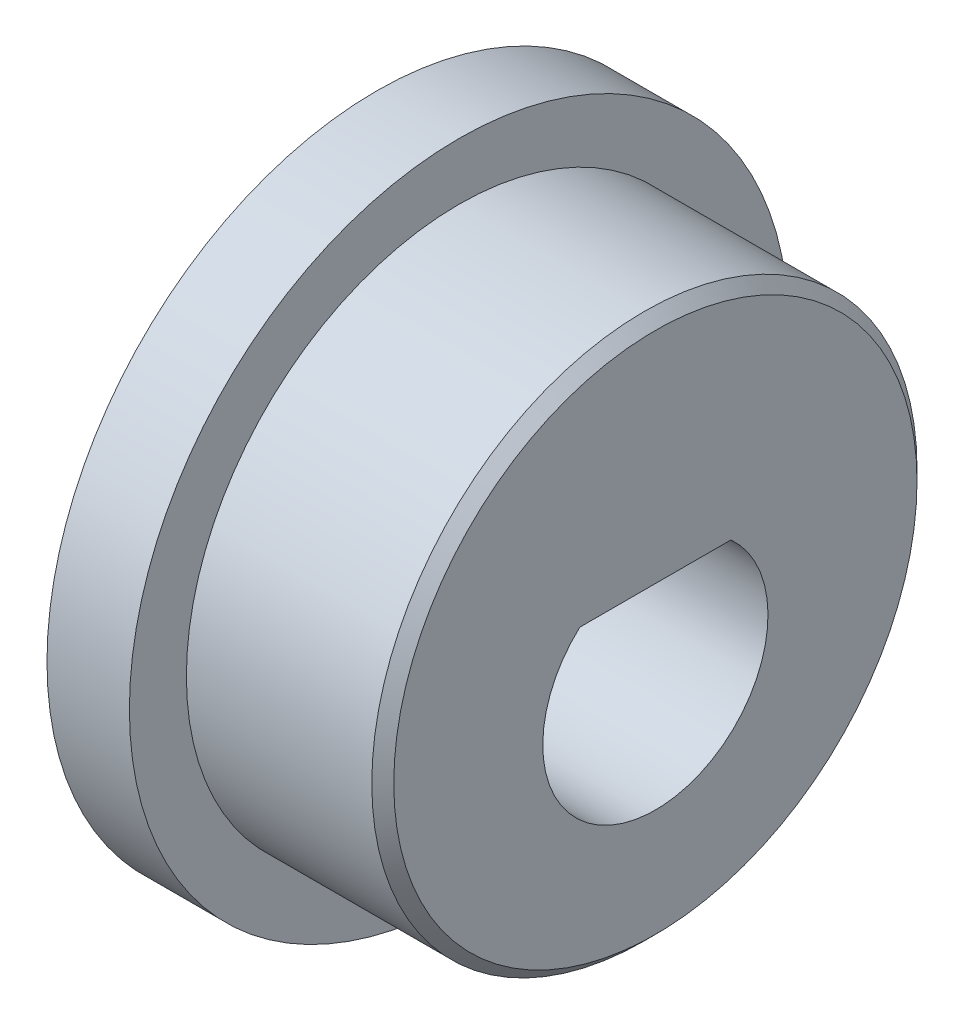
from build123d import *

# Parameters (mm, degrees)
SKIZZE1_R                            = 9.925
AUFSATZ_LINEAR_AUSTRAGEN1_DEPTH      = 7.15
SKIZZE2_R                            = 12
AUFSATZ_LINEAR_AUSTRAGEN2_DEPTH      = 3
SCHNITT_LINEAR_AUSTRAGEN2_DEPTH      = 21.718892345
SCHNITT_LINEAR_AUSTRAGEN2_DEPTH_BACK = 21.718892345
FASE1_SIZE                           = 0.4


with BuildPart() as part:
    # Skizze1 → Aufsatz-Linear austragen1 (new body)
    with BuildSketch(Plane(origin=(0, 0, 0), x_dir=(0, 0, -1), z_dir=(1, 0, 0))):
        with Locations((0, 1.5)):
            Circle(SKIZZE1_R)
    extrude(amount=AUFSATZ_LINEAR_AUSTRAGEN1_DEPTH)

    # Skizze2 → Aufsatz-Linear austragen2 (add)
    with BuildSketch(Plane.ZY):
        with Locations((0, 1.5)):
            Circle(SKIZZE2_R)
    extrude(amount=AUFSATZ_LINEAR_AUSTRAGEN2_DEPTH)

    # Skizze3 → Schnitt-Linear austragen2 (cut, two sides: drawn at the far end of the back side and taken through both)
    with BuildSketch(Plane(origin=(7.15, 0, 0), x_dir=(0, 0, -1), z_dir=(1, 0, 0)).offset(-SCHNITT_LINEAR_AUSTRAGEN2_DEPTH_BACK)):
        with BuildLine():
            Line((-2.75, 3.04097024), (2.75, 3.04097024))
            ThreePointArc((2.75, 3.04097024), (0, -4.1), (-2.75, 3.04097024))
        make_face()
    extrude(amount=SCHNITT_LINEAR_AUSTRAGEN2_DEPTH + SCHNITT_LINEAR_AUSTRAGEN2_DEPTH_BACK, mode=Mode.SUBTRACT)

    # Fase1
    fase1_edges = [part.edges().sort_by_distance(p)[0] for p in [
        (7.15, 1.5, 9.925),
    ]]
    chamfer(fase1_edges, length=FASE1_SIZE)


solid = part.part
